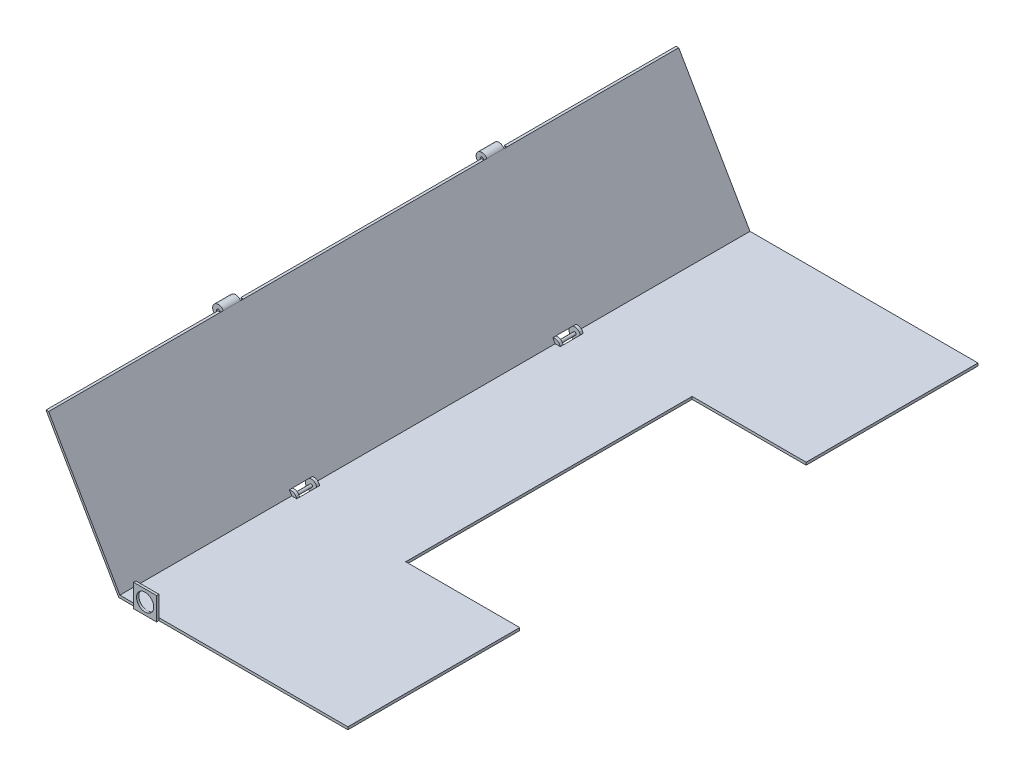
from build123d import *

# Parameters (mm, degrees)
BOSS_EXTRUDE1_DEPTH = 550
SKETCH2_W           = 99.516911358
SKETCH2_H           = 250
CUT_EXTRUDE1_DEPTH  = 596.064959308
SKETCH4_R           = 5
CUT_EXTRUDE2_DEPTH  = 20
SKETCH4_3_R         = 5
BOSS_EXTRUDE3_DEPTH = 2.5
BOSS_EXTRUDE4_START = 17.5
SKETCH4_5_R         = 5
BOSS_EXTRUDE4_DEPTH = 2.5
SKETCH4_7_R         = 1.240896304
BOSS_EXTRUDE5_DEPTH = 17.5
BOSS_EXTRUDE6_START = -150
SKETCH5_R           = 5
SKETCH5_R_2         = 1.5
BOSS_EXTRUDE6_DEPTH = 19.5
CUT_EXTRUDE5_START  = -167.5
SKETCH5_4_R         = 5
CUT_EXTRUDE5_DEPTH  = 2.5
CUT_EXTRUDE6_START  = -150
SKETCH5_6_R         = 5
CUT_EXTRUDE6_DEPTH  = 2.5
SKETCH7_W           = 20
SKETCH7_H           = 20
SKETCH7_R           = 7.5
BOSS_EXTRUDE7_DEPTH = 2


with BuildPart() as part:
    # Sketch1 → Boss-Extrude1 (new body)
    with BuildSketch(Plane.XY):
        Polygon((0, 0), (-63.508529611, 110), (-61.222529611, 110), (0.966177285, 2.286), (200, 2.286), (200, 0), align=None)
    extrude(amount=BOSS_EXTRUDE1_DEPTH)

    # Sketch2 → Cut-Extrude1 (cut, through all)
    with BuildSketch(Plane(origin=(0, 2.286, 0), x_dir=(1, 0, 0), z_dir=(0, 1, 0))):
        with Locations((150.241544321, -275)):
            Rectangle(SKETCH2_W, SKETCH2_H)
    extrude(amount=-CUT_EXTRUDE1_DEPTH, mode=Mode.SUBTRACT)

    # Sketch4 → Cut-Extrude2 (cut)
    with BuildSketch(Plane.XY.offset(150)):
        with Locations((0.483088642, 1.143)):
            Circle(SKETCH4_R)
    cut_extrude2 = extrude(amount=CUT_EXTRUDE2_DEPTH, mode=Mode.SUBTRACT)

    # Sketch4<3> → Boss-Extrude3 (add)
    with BuildSketch(Plane.XY.offset(150)):
        with Locations((0.483088642, 1.143)):
            Circle(SKETCH4_3_R)
    boss_extrude3 = extrude(amount=BOSS_EXTRUDE3_DEPTH)

    # Sketch4<5> → Boss-Extrude4 (add)
    with BuildSketch(Plane.XY.offset(150).offset(BOSS_EXTRUDE4_START)):
        with Locations((0.483088642, 1.143)):
            Circle(SKETCH4_5_R)
    boss_extrude4 = extrude(amount=BOSS_EXTRUDE4_DEPTH)

    # Sketch4<7> → Boss-Extrude5 (add)
    with BuildSketch(Plane.XY.offset(150)):
        with Locations((0.483088642, 1.143)):
            Circle(SKETCH4_7_R)
    boss_extrude5 = extrude(amount=BOSS_EXTRUDE5_DEPTH)

    # Mirror1: Cut-Extrude2, Boss-Extrude3, Boss-Extrude4, Boss-Extrude5 across plane
    add(cut_extrude2.mirror(Plane.XY.offset(275)), mode=Mode.SUBTRACT)
    add(boss_extrude3.mirror(Plane.XY.offset(275)))
    add(boss_extrude4.mirror(Plane.XY.offset(275)))
    add(boss_extrude5.mirror(Plane.XY.offset(275)))

    # Sketch5 → Boss-Extrude6 (add)
    with BuildSketch(Plane.XY.offset(550).offset(BOSS_EXTRUDE6_START)):
        with Locations((-65.55265663, 107.5)):
            Circle(SKETCH5_R)
        with Locations((-65.55265663, 107.5)):
            Circle(SKETCH5_R_2, mode=Mode.SUBTRACT)
    boss_extrude6 = extrude(amount=-BOSS_EXTRUDE6_DEPTH)

    # Sketch5<4> → Cut-Extrude5 (cut)
    with BuildSketch(Plane.XY.offset(550).offset(CUT_EXTRUDE5_START)):
        with Locations((-65.55265663, 107.5)):
            Circle(SKETCH5_4_R)
    cut_extrude5 = extrude(amount=-CUT_EXTRUDE5_DEPTH, mode=Mode.SUBTRACT)

    # Sketch5<6> → Cut-Extrude6 (cut)
    with BuildSketch(Plane.XY.offset(550).offset(CUT_EXTRUDE6_START)):
        with Locations((-65.55265663, 107.5)):
            Circle(SKETCH5_6_R)
    cut_extrude6 = extrude(amount=-CUT_EXTRUDE6_DEPTH, mode=Mode.SUBTRACT)

    # Mirror2: Boss-Extrude6, Cut-Extrude5, Cut-Extrude6 across plane
    add(boss_extrude6.mirror(Plane.XY.offset(275)))
    add(cut_extrude5.mirror(Plane.XY.offset(275)), mode=Mode.SUBTRACT)
    add(cut_extrude6.mirror(Plane.XY.offset(275)), mode=Mode.SUBTRACT)

    # Sketch7 → Boss-Extrude7 (add)
    with BuildSketch(Plane.XY.offset(550)):
        with Locations((25, 10)):
            Rectangle(SKETCH7_W, SKETCH7_H)
        with Locations((25, 10)):
            Circle(SKETCH7_R, mode=Mode.SUBTRACT)
    extrude(amount=BOSS_EXTRUDE7_DEPTH)


solid = part.part
